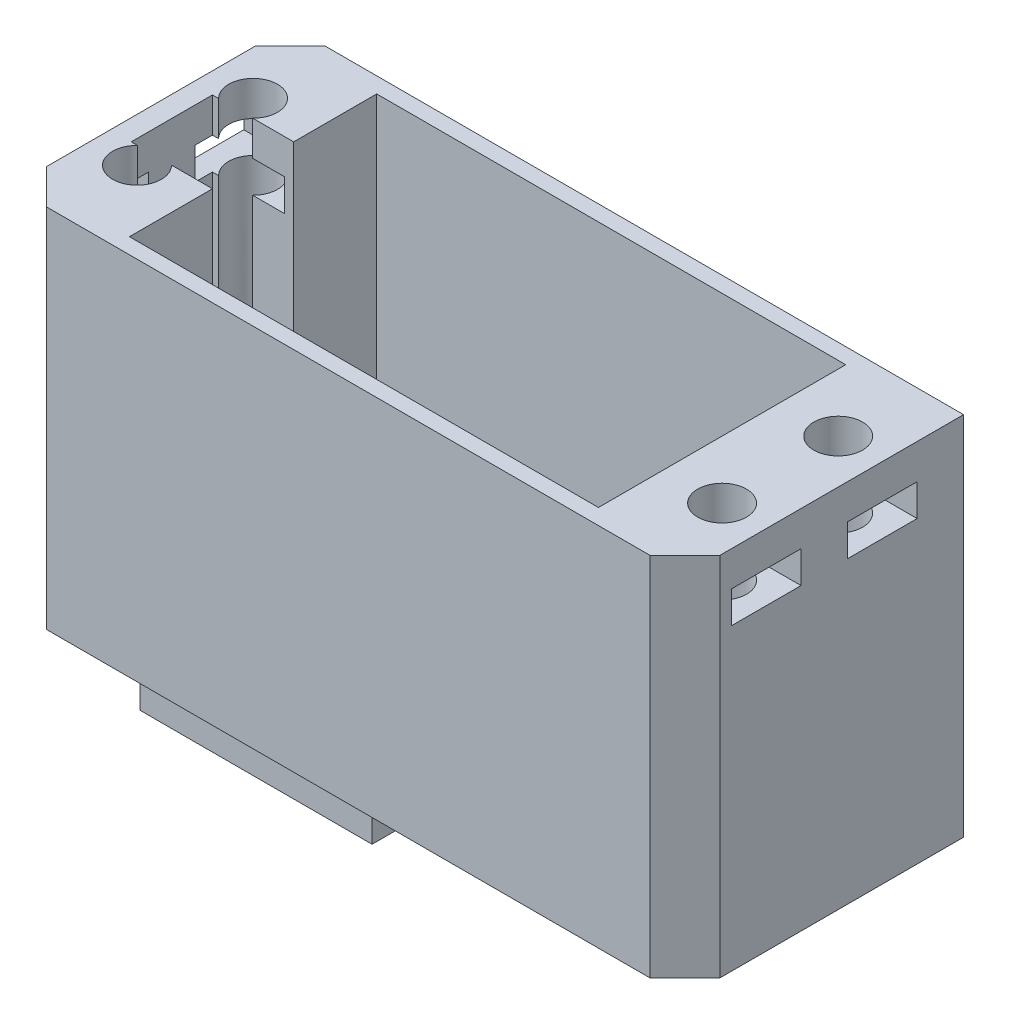
from build123d import *

# Parameters (mm, degrees)
SKETCH1_W           = 58
SKETCH1_H           = 24
SKETCH1_R           = 2.1
SKETCH1_W_2         = 40.4
SKETCH1_H_2         = 21.3
BOSS_EXTRUDE1_DEPTH = 28.35
SKETCH11_W          = 58
SKETCH11_H          = 24
BOSS_EXTRUDE5_DEPTH = 3.175
SKETCH14_W          = 24
SKETCH14_H          = 12
BOSS_EXTRUDE7_DEPTH = 10
CUT_EXTRUDE1_DEPTH  = 3.8
FILLET1_R           = 8
CHAMFER2_SIZE       = 3
CHAMFER3_SIZE       = 1
SKETCH19_W          = 8
SKETCH19_H          = 6
CUT_EXTRUDE3_DEPTH  = 2.75
SKETCH20_W          = 8.8
SKETCH20_H          = 8.5
CUT_EXTRUDE4_DEPTH  = 4
SKETCH21_W          = 20
SKETCH21_H          = 20
BOSS_EXTRUDE8_DEPTH = 6
SKETCH13_R          = 2.55
BOSS_EXTRUDE6_DEPTH = 5
FILLET4_R           = 1
CHAMFER4_SIZE       = 2
FILLET5_R           = 1
CUT_EXTRUDE5_REACH  = 77.835
SKETCH22_W          = 7
SKETCH22_H          = 7


with BuildPart() as part:
    # Sketch1 → Boss-Extrude1 (new body)
    with BuildSketch(Plane(origin=(0, 0, 0), x_dir=(1, 0, 0), z_dir=(0, 1, 0))):
        with Locations((29.95, -9.622651473)):
            Rectangle(SKETCH1_W, SKETCH1_H)
        with Locations(Location((55.15, -4.622651473, 0), (0, 0, 270))):
            Circle(SKETCH1_R, mode=Mode.SUBTRACT)
        with Locations(Location((55.15, -14.622651473, 0), (0, 0, 270))):
            Circle(SKETCH1_R, mode=Mode.SUBTRACT)
        with Locations(Location((4.75, -14.622651473, 0), (0, 0, 90))):
            Circle(SKETCH1_R, mode=Mode.SUBTRACT)
        with Locations(Location((4.75, -4.622651473, 0), (0, 0, 90))):
            Circle(SKETCH1_R, mode=Mode.SUBTRACT)
        with Locations((29.95, -9.622651473)):
            Rectangle(SKETCH1_W_2, SKETCH1_H_2, mode=Mode.SUBTRACT)
    extrude(amount=BOSS_EXTRUDE1_DEPTH)

    # Sketch11 → Boss-Extrude5 (add)
    with BuildSketch(Plane.XZ):
        with Locations((29.95, 9.622651473)):
            Rectangle(SKETCH11_W, SKETCH11_H)
    extrude(amount=BOSS_EXTRUDE5_DEPTH)

    # Sketch14 → Boss-Extrude7 (add)
    with BuildSketch(Plane(origin=(0, 0, -2.377348527), x_dir=(-1, 0, 0), z_dir=(0, 0, -1))):
        with Locations((-12.95, 12.5875)):
            Rectangle(SKETCH14_W, SKETCH14_H)
    extrude(amount=BOSS_EXTRUDE7_DEPTH)

    # Sketch16 → Cut-Extrude1 (cut, symmetric)
    with BuildSketch(Plane(origin=(0, 0, -7.377348527), x_dir=(-1, 0, 0), z_dir=(0, 0, -1))):
        with BuildLine():
            Line((-11.45, 16.7875), (-24.95, 16.7875))
            Line((-24.95, 16.7875), (-24.95, 8.3875))
            Line((-24.95, 8.3875), (-11.45, 8.3875))
            ThreePointArc((-11.45, 8.3875), (-7.25, 12.5875), (-11.45, 16.7875))
        make_face()
    extrude(amount=CUT_EXTRUDE1_DEPTH, both=True, mode=Mode.SUBTRACT)

    # Fillet1
    fillet1_edges = [part.edges().sort_by_distance(p)[0] for p in [
        (12.95, 6.5875, -2.377348527),
        (12.95, 18.5875, -2.377348527),
    ]]
    fillet(fillet1_edges, radius=FILLET1_R)

    # Chamfer2
    chamfer2_edges = [part.edges().sort_by_distance(p)[0] for p in [
        (0.95, 6.5875, -11.377348527),
        (0.95, 18.5875, -11.377348527),
        (58.95, 12.5875, 21.622651473),
        (0.95, 12.5875, 21.622651473),
        (0.95, 27.46875, -2.377348527),
        (0.95, -2.29375, -2.377348527),
        (0.95, 4.244354249, -4.720494277),
        (0.95, 20.930645751, -4.720494277),
    ]]
    chamfer(chamfer2_edges, length=CHAMFER2_SIZE)

    # Chamfer3
    chamfer3_edges = [part.edges().sort_by_distance(p)[0] for p in [
        (0.95, 12.5875, -12.377348527),
        (14.45, 18.5875, -12.377348527),
        (24.95, 12.5875, -12.377348527),
        (14.45, 6.5875, -12.377348527),
    ]]
    chamfer(chamfer3_edges, length=CHAMFER3_SIZE)

    # Sketch19 → Cut-Extrude3 (cut)
    with BuildSketch(Plane(origin=(0, 25.35, 0), x_dir=(1, 0, 0), z_dir=(0, 1, 0))):
        with Locations((4.95, -4.622651473)):
            Rectangle(SKETCH19_W, SKETCH19_H)
        with Locations((4.95, -14.622651473)):
            Rectangle(SKETCH19_W, SKETCH19_H)
        with Locations((54.95, -14.622651473)):
            Rectangle(SKETCH19_W, SKETCH19_H)
        with Locations((54.95, -4.622651473)):
            Rectangle(SKETCH19_W, SKETCH19_H)
    extrude(amount=-CUT_EXTRUDE3_DEPTH, mode=Mode.SUBTRACT)

    # Sketch20 → Cut-Extrude4 (cut)
    with BuildSketch(Plane(origin=(0, 0, 0), x_dir=(1, 0, 0), z_dir=(0, 1, 0))):
        with Locations((5.35, -9.622651473)):
            Rectangle(SKETCH20_W, SKETCH20_H)
    extrude(amount=CUT_EXTRUDE4_DEPTH, mode=Mode.SUBTRACT)

    # Sketch21 → Boss-Extrude8 (add)
    with BuildSketch(Plane.XZ.offset(3.175)):
        with Locations((20, 9.622651473)):
            Rectangle(SKETCH21_W, SKETCH21_H)
    extrude(amount=BOSS_EXTRUDE8_DEPTH)

    # Sketch13 → Boss-Extrude6 (add)
    with BuildSketch(Plane.XZ.offset(9.175)):
        with Locations(Location((20, 9.622651473, 0), (0, 0, 270))):
            Circle(SKETCH13_R)
    extrude(amount=BOSS_EXTRUDE6_DEPTH)

    # Fillet4
    fillet4_edges = [part.edges().sort_by_distance(p)[0] for p in [
        (10, -3.175, 9.622651473),
        (20, -3.175, -0.377348527),
        (30, -3.175, 9.622651473),
        (20, -3.175, 19.622651473),
    ]]
    fillet(fillet4_edges, radius=FILLET4_R)

    # Chamfer4
    chamfer4_edges = [part.edges().sort_by_distance(p)[0] for p in [
        (10, -9.175, 9.622651473),
        (20, -9.175, -0.377348527),
        (30, -9.175, 9.622651473),
        (20, -9.175, 19.622651473),
    ]]
    chamfer(chamfer4_edges, length=CHAMFER4_SIZE)

    # Fillet5
    fillet5_edges = [part.edges().sort_by_distance(p)[0] for p in [
        (20, -14.175, 12.172651473),
    ]]
    fillet(fillet5_edges, radius=FILLET5_R)

    # Cut-Extrude5: up to this face of the body (flat: up to its plane)
    cut_extrude5_end = Plane(part.part.faces().sort_by_distance((55.15, 0, 14.622651473))[0])
    # Sketch22 → Cut-Extrude5 (cut, up to the picked face)
    with BuildSketch(Plane(origin=(0, 28.35, 0), x_dir=(1, 0, 0), z_dir=(0, 1, 0)), mode=Mode.PRIVATE) as cut_extrude5_sk1:
        with Locations((6.25, -9.622651473)):
            Rectangle(SKETCH22_W, SKETCH22_H)
    cut_extrude5_tool1 = split(extrude(cut_extrude5_sk1.sketch, amount=-CUT_EXTRUDE5_REACH, mode=Mode.PRIVATE), bisect_by=cut_extrude5_end, keep=Keep.BOTH, mode=Mode.PRIVATE)
    add(cut_extrude5_tool1.solids().sort_by(Axis((6.25, 28.35, 9.622651), (0, -1, 0)))[0], mode=Mode.SUBTRACT)


solid = part.part
